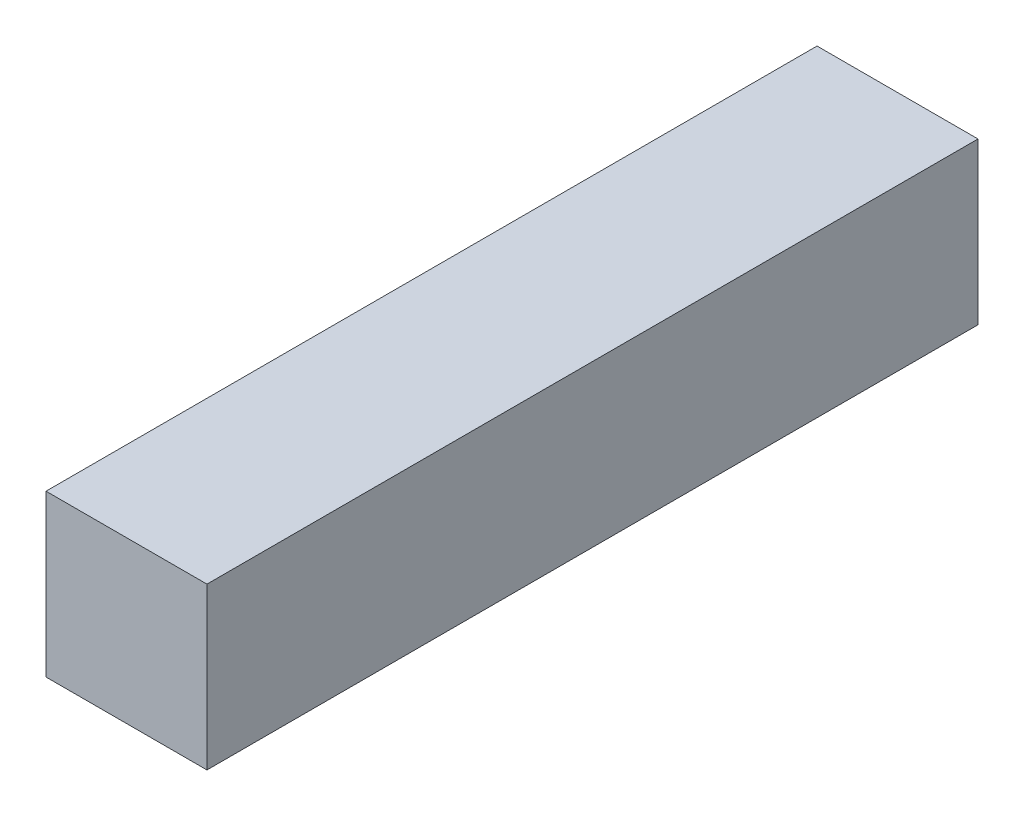
from build123d import *

# Parameters (mm, degrees)
SKETCH1_W           = 16.7
SKETCH1_H           = 16.7
BOSS_EXTRUDE1_DEPTH = 40


with BuildPart() as part:
    # Sketch1 → Boss-Extrude1 (new, symmetric)
    with BuildSketch(Plane.XY):
        Rectangle(SKETCH1_W, SKETCH1_H)
    extrude(amount=BOSS_EXTRUDE1_DEPTH, both=True)


solid = part.part
